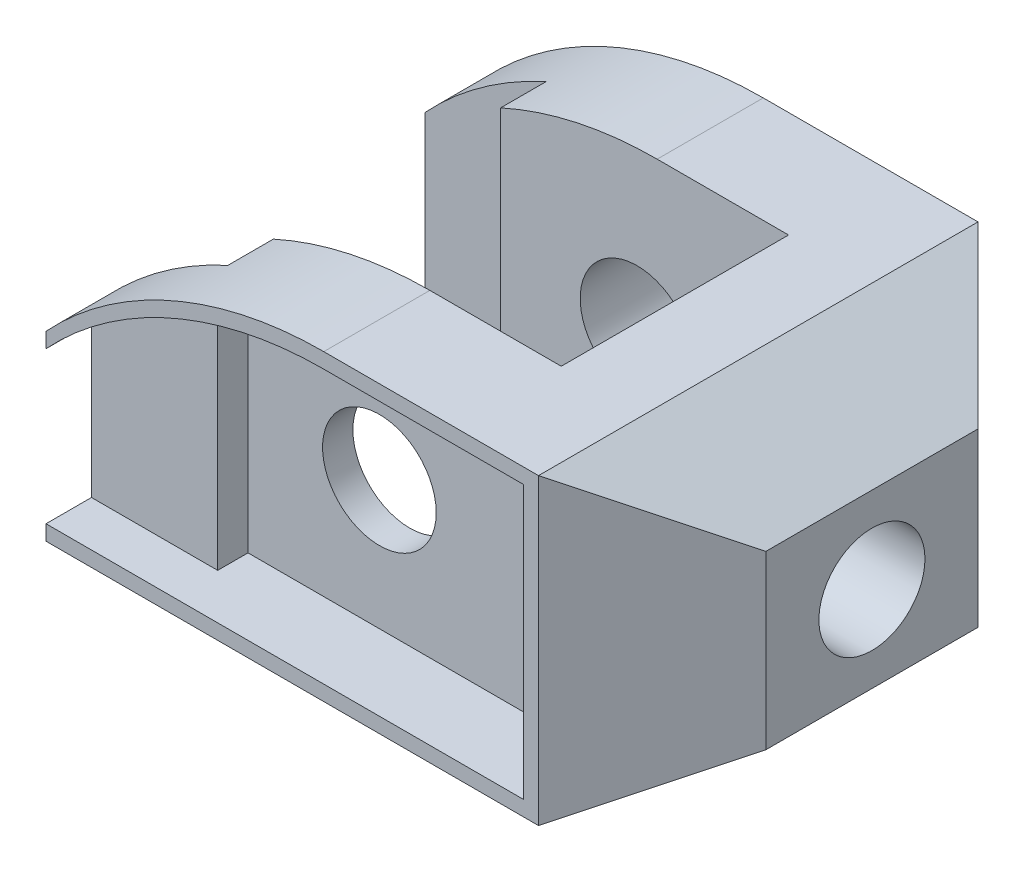
from build123d import *

# Parameters (mm, degrees)
SKETCH1_W           = 80
SKETCH1_H           = 58
BOSS_EXTRUDE1_DEPTH = 40
SKETCH2_R           = 7.5
CUT_EXTRUDE1_DEPTH  = 82.018516402
CUT_EXTRUDE6_DEPTH  = 64.568860301
SKETCH4_R           = 7
CUT_EXTRUDE7_DEPTH  = 95.026591983
CUT_EXTRUDE8_DEPTH  = 6
CUT_EXTRUDE9_DEPTH  = 4


with BuildPart() as part:
    # Sketch1 → Boss-Extrude1 (new body)
    with BuildSketch(Plane(origin=(0, 0, 0), x_dir=(1, 0, 0), z_dir=(0, 1, 0))):
        Rectangle(SKETCH1_W, SKETCH1_H)
    extrude(amount=BOSS_EXTRUDE1_DEPTH)

    # Sketch2 → Cut-Extrude1 (cut, through all)
    with BuildSketch(Plane.XY.offset(29)):
        Polygon((40, 40), (25, 40), (40, 31.339745962), align=None)
        with BuildLine():
            ThreePointArc((-40, 24), (-23.33939444, 35.82575695), (-3.33939444, 40))
            Line((-3.33939444, 40), (-40, 40))
            Line((-40, 40), (-40, 24))
        make_face()
        Polygon((40, 0), (40, 8.660254038), (25, 0), align=None)
        with Locations((-6, 19)):
            Circle(SKETCH2_R)
    extrude(amount=-CUT_EXTRUDE1_DEPTH, mode=Mode.SUBTRACT)

    # Sketch3 → Cut-Extrude6 (cut, through all)
    with BuildSketch(Plane(origin=(0, 0, 0), x_dir=(1, 0, 0), z_dir=(0, 1, 0))):
        Polygon((25, 29), (40, 29), (40, 14), align=None)
        Polygon((40, -14), (25, -29), (40, -29), align=None)
        Polygon((-40, 21), (-24, 21), (-24, 15), (14, 15), (14, -15), (-24, -15), (-24, -21), (-40, -21), align=None)
    extrude(amount=CUT_EXTRUDE6_DEPTH, mode=Mode.SUBTRACT)

    # Sketch4 → Cut-Extrude7 (cut, through all)
    with BuildSketch(Plane(origin=(40, 0, 0), x_dir=(0, 0, -1), z_dir=(1, 0, 0))):
        with Locations((0, 20)):
            Circle(SKETCH4_R)
    extrude(amount=-CUT_EXTRUDE7_DEPTH, mode=Mode.SUBTRACT)

    # Sketch5 → Cut-Extrude8 (cut)
    with BuildSketch(Plane.XY.offset(29)):
        with BuildLine():
            Line((-40, 2), (23, 2))
            Line((23, 2), (23, 38))
            Line((23, 38), (-3.33939444, 38))
            ThreePointArc((-3.33939444, 38), (-23.33939444, 33.82575695), (-40, 22))
            Line((-40, 22), (-40, 2))
        make_face()
    extrude(amount=-CUT_EXTRUDE8_DEPTH, mode=Mode.SUBTRACT)

    # Sketch6 → Cut-Extrude9 (cut)
    with BuildSketch(Plane.XY.offset(23)):
        with BuildLine():
            Line((-23.33939444, 33.82575695), (-23.33939444, 2))
            Line((-23.33939444, 2), (23, 2))
            Line((23, 2), (23, 38))
            Line((23, 38), (-3.33939444, 38))
            ThreePointArc((-3.33939444, 38), (-13.554876625, 36.945315647), (-23.33939444, 33.82575695))
        make_face()
    extrude(amount=-CUT_EXTRUDE9_DEPTH, mode=Mode.SUBTRACT)


solid = part.part
